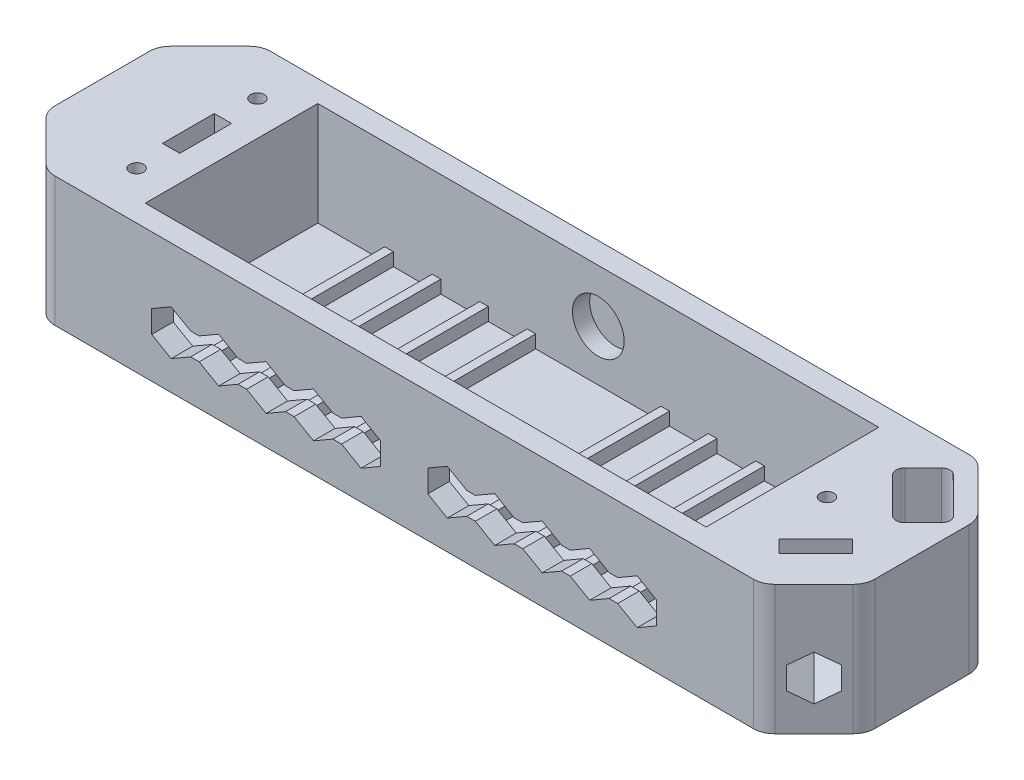
from build123d import *

# Parameters (mm, degrees)
BOSS_EXTRUDE1_DEPTH     = 15
SKETCH3_W               = 65
SKETCH3_H               = 20
CUT_EXTRUDE2_DEPTH      = 12
CUT_EXTRUDE4_DEPTH      = 52.35659646
M2_TAPPED_HOLE1_D       = 1.6
M2_TAPPED_HOLE1_DEPTH   = 4.519311505
M2_TAPPED_HOLE1_TIP     = 0.480688495
FILLET4_R               = 2.5
SKETCH15_R              = 3
CUT_EXTRUDE10_DEPTH     = 2
CUT_EXTRUDE11_DEPTH     = 8
CUT_EXTRUDE12_DEPTH     = 10
CUT_EXTRUDE13_DEPTH     = 10
SKETCH19_W              = 0.9966679
SKETCH19_H              = 1.5
BOSS_EXTRUDE2_DEPTH     = 20
LPATTERN1_COUNT         = 4
LPATTERN1_PITCH         = 5.5
MIRROR2_COPY_1_SKETCH_W = 0.9966679
MIRROR2_COPY_1_SKETCH_H = 1.5
MIRROR2_COPY_1_DEPTH    = 20
MIRROR2_COPY_2_SKETCH_W = 0.9966679
MIRROR2_COPY_2_SKETCH_H = 1.5
MIRROR2_COPY_2_DEPTH    = 20
MIRROR2_COPY_3_SKETCH_W = 0.9966679
MIRROR2_COPY_3_SKETCH_H = 1.5
MIRROR2_COPY_3_DEPTH    = 20
SKETCH20_W              = 2
SKETCH20_H              = 6
CUT_EXTRUDE14_DEPTH     = 6.5


with BuildPart() as part:
    # Sketch1 → Boss-Extrude1 (new body)
    with BuildSketch(Plane(origin=(0, 0, 0), x_dir=(1, 0, 0), z_dir=(0, 1, 0))):
        Polygon((-47.5, -6.5), (-41.5, -12.5), (41.5, -12.5), (47.5, -6.5), (47.5, 6.5), (41.5, 12.5), (-41.5, 12.5), (-47.5, 6.5), align=None)
    extrude(amount=BOSS_EXTRUDE1_DEPTH)

    # Sketch3 → Cut-Extrude2 (cut)
    with BuildSketch(Plane(origin=(0, 15, 0), x_dir=(1, 0, 0), z_dir=(0, 1, 0))):
        Rectangle(SKETCH3_W, SKETCH3_H)
    extrude(amount=-CUT_EXTRUDE2_DEPTH, mode=Mode.SUBTRACT)

    # Sketch4 → Cut-Extrude4 (cut, through all)
    with BuildSketch(Plane(origin=(0, 15, 0), x_dir=(1, 0, 0), z_dir=(0, 1, 0))):
        with BuildLine():
            Line((41.610912703, 9.560660172), (45.696699141, 5.474873734))
            ThreePointArc((45.696699141, 5.474873734), (45.98959236, 4.767766953), (45.696699141, 4.060660172))
            Line((45.696699141, 4.060660172), (43.575378798, 1.939339828))
            ThreePointArc((43.575378798, 1.939339828), (42.868272016, 1.646446609), (42.161165235, 1.939339828))
            Line((42.161165235, 1.939339828), (38.075378798, 6.025126266))
            ThreePointArc((38.075378798, 6.025126266), (37.782485579, 6.732233047), (38.075378798, 7.439339828))
            Line((38.075378798, 7.439339828), (40.196699141, 9.560660172))
            ThreePointArc((40.196699141, 9.560660172), (40.903805922, 9.853553391), (41.610912703, 9.560660172))
        make_face()
    extrude(amount=-CUT_EXTRUDE4_DEPTH, mode=Mode.SUBTRACT)

    # M2 Tapped Hole1
    with Locations(Plane(origin=(-36.5, 15, 7), x_dir=(0, 0, 1), z_dir=(0, 1, 0))):
        with Locations((0, 0), (-14, 0), (-7, 73)):
            Hole(M2_TAPPED_HOLE1_D / 2, depth=M2_TAPPED_HOLE1_DEPTH)
            with Locations((0, 0, -(M2_TAPPED_HOLE1_DEPTH + M2_TAPPED_HOLE1_TIP / 2))):  # 118° drill point
                Cone(0, M2_TAPPED_HOLE1_D / 2, M2_TAPPED_HOLE1_TIP, mode=Mode.SUBTRACT)

    # Fillet4
    fillet4_edges = [part.edges().sort_by_distance(p)[0] for p in [
        (-47.5, 7.5, -6.5),
        (-41.5, 7.5, -12.5),
        (41.5, 7.5, -12.5),
        (47.5, 7.5, -6.5),
        (47.5, 7.5, 6.5),
        (41.5, 7.5, 12.5),
        (-41.5, 7.5, 12.5),
        (-47.5, 7.5, 6.5),
    ]]
    fillet(fillet4_edges, radius=FILLET4_R)

    # Sketch15 → Cut-Extrude10 (cut)
    with BuildSketch(Plane.XY.offset(-10)):
        with Locations((0, 8.884553107)):
            Circle(SKETCH15_R)
    extrude(amount=-CUT_EXTRUDE10_DEPTH, mode=Mode.SUBTRACT)

    # Sketch16 → Cut-Extrude11 (cut)
    with BuildSketch(Plane.ZY.offset(47.5)):
        Polygon((0, 10.1), (-2.25166605, 8.8), (-2.25166605, 6.2), (0, 4.9), (2.25166605, 6.2), (2.25166605, 8.8), align=None)
    extrude(amount=-CUT_EXTRUDE11_DEPTH, mode=Mode.SUBTRACT)

    # Sketch5 → Cut-Extrude12 (cut)
    with BuildSketch(Plane(origin=(27, 0, 27), x_dir=(0.7071067811865469, 0, -0.7071067811865481), z_dir=(0.7071067811865481, 0, 0.7071067811865469))):
        Polygon((24.748737342, 8.2), (22.497071292, 6.9), (22.497071292, 4.3), (24.748737342, 3), (27.000403391, 4.3), (27.000403391, 6.9), align=None)
    extrude(amount=-CUT_EXTRUDE12_DEPTH, mode=Mode.SUBTRACT)

    # Sketch17 → Cut-Extrude13 (cut)
    with BuildSketch(Plane.XY.offset(12.5)):
        Polygon((8.24833395, 7.3), (7.25166605, 7.3), (5, 8.6), (2.74833395, 7.3), (2.74833395, 4.7), (5, 3.4), (7.25166605, 4.7), (8.24833395, 4.7), (10.5, 3.4), (12.75166605, 4.7), (13.74833395, 4.7), (16, 3.4), (18.25166605, 4.7), (19.24833395, 4.7), (21.5, 3.4), (23.75166605, 4.7), (24.74833395, 4.7), (27, 3.4), (29.25166605, 4.7), (29.25166605, 7.3), (27, 8.6), (24.74833395, 7.3), (23.75166605, 7.3), (21.5, 8.6), (19.24833395, 7.3), (18.25166605, 7.3), (16, 8.6), (13.74833395, 7.3), (12.75166605, 7.3), (10.5, 8.6), align=None)
    cut_extrude13 = extrude(amount=-CUT_EXTRUDE13_DEPTH, mode=Mode.SUBTRACT)

    # Mirror1: Cut-Extrude13 across plane
    add(cut_extrude13.mirror(Plane(origin=(0, 0, 0), x_dir=(0, 0, 1), z_dir=(1, 0, 0))), mode=Mode.SUBTRACT)

    # Sketch19 → Boss-Extrude2 (add)
    with BuildSketch(Plane(origin=(0, 0, 10), x_dir=(-1, 0, 0), z_dir=(0, 0, -1))):
        with Locations((-24.25, 3.75)):
            Rectangle(SKETCH19_W, SKETCH19_H)
    boss_extrude2 = extrude(amount=BOSS_EXTRUDE2_DEPTH)

    # LPattern1: Boss-Extrude2 ×4
    with Locations(*[(-i * LPATTERN1_PITCH, 0, 0) for i in range(1, LPATTERN1_COUNT)]):
        add(boss_extrude2)

    # Mirror2: Boss-Extrude2 across plane
    add(boss_extrude2.mirror(Plane(origin=(0, 0, 0), x_dir=(0, 0, 1), z_dir=(1, 0, 0))))

    # Mirror2 copy 1 sketch → Mirror2 copy 1 (add)
    with BuildSketch(Plane(origin=(5.5, 0, 10), x_dir=(1, 0, 0), z_dir=(0, 0, -1))):
        with Locations((-24.25, -3.75)):
            Rectangle(MIRROR2_COPY_1_SKETCH_W, MIRROR2_COPY_1_SKETCH_H)
    extrude(amount=MIRROR2_COPY_1_DEPTH)

    # Mirror2 copy 2 sketch → Mirror2 copy 2 (add)
    with BuildSketch(Plane(origin=(11, 0, 10), x_dir=(1, 0, 0), z_dir=(0, 0, -1))):
        with Locations((-24.25, -3.75)):
            Rectangle(MIRROR2_COPY_2_SKETCH_W, MIRROR2_COPY_2_SKETCH_H)
    extrude(amount=MIRROR2_COPY_2_DEPTH)

    # Mirror2 copy 3 sketch → Mirror2 copy 3 (add)
    with BuildSketch(Plane(origin=(16.5, 0, 10), x_dir=(1, 0, 0), z_dir=(0, 0, -1))):
        with Locations((-24.25, -3.75)):
            Rectangle(MIRROR2_COPY_3_SKETCH_W, MIRROR2_COPY_3_SKETCH_H)
    extrude(amount=MIRROR2_COPY_3_DEPTH)

    # Sketch20 → Cut-Extrude14 (cut)
    with BuildSketch(Plane(origin=(0, 15, 0), x_dir=(1, 0, 0), z_dir=(0, 1, 0))):
        Polygon((39.364466094, -8.407106781), (37.950252532, -6.992893219), (42.192893219, -2.750252532), (43.607106781, -4.164466094), align=None)
        with Locations((-36.5, 0)):
            Rectangle(SKETCH20_W, SKETCH20_H)
    extrude(amount=-CUT_EXTRUDE14_DEPTH, mode=Mode.SUBTRACT)


solid = part.part
